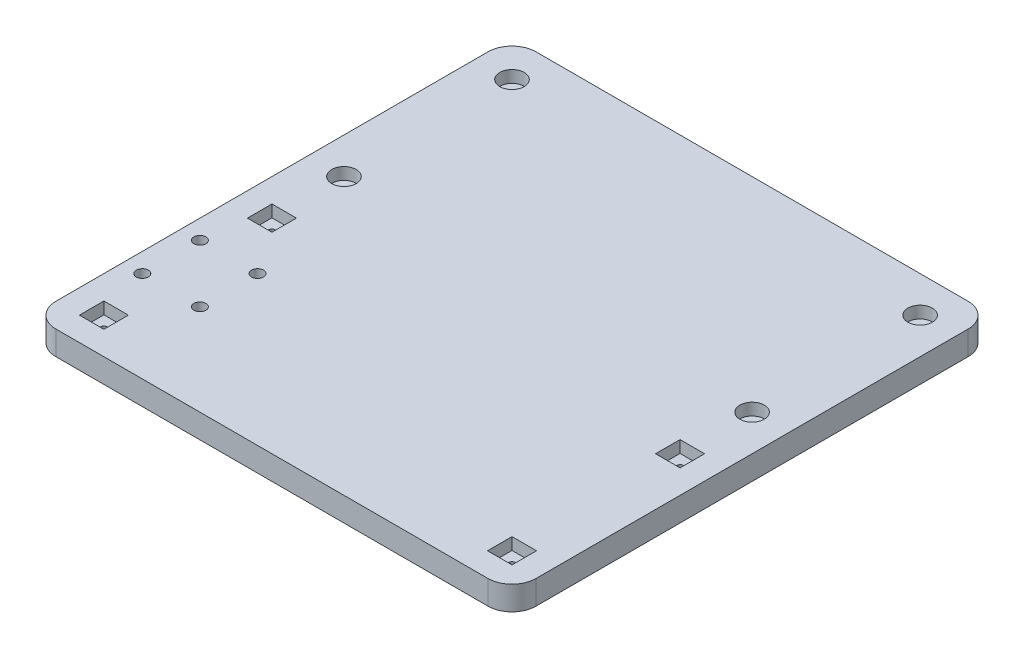
from build123d import *

# Parameters (mm, degrees)
SKETCH_1_W          = 200
SKETCH_1_H          = 200
EXTRUDE_1_DEPTH     = 10
SKETCH_2_W          = 10.2
SKETCH_2_H          = 10.2
CUT_EXTRUDE_3_DEPTH = 5
FILLET_1_R          = 10
SKETCH_3_R          = 5.1
CUT_EXTRUDE_1_DEPTH = 5
SKETCH_4_R          = 2.5
CUT_EXTRUDE_2_DEPTH = 142.774468788
SKETCH_5_R          = 1.5
CUT_EXTRUDE_4_DEPTH = 142.774468788


with BuildPart() as part:
    # ｽｹｯﾁ1 → ﾎﾞｽ - 押し出し1 (new body)
    with BuildSketch(Plane(origin=(0, 0, 0), x_dir=(1, 0, 0), z_dir=(0, 1, 0))):
        Rectangle(SKETCH_1_W, SKETCH_1_H)
    extrude(amount=EXTRUDE_1_DEPTH)

    # ｽｹｯﾁ2 → ｶｯﾄ - 押し出し3 (cut)
    with BuildSketch(Plane(origin=(0, 10, 0), x_dir=(1, 0, 0), z_dir=(0, 1, 0))):
        with Locations((-85, -15)):
            Rectangle(SKETCH_2_W, SKETCH_2_H)
        with Locations((85, -15)):
            Rectangle(SKETCH_2_W, SKETCH_2_H)
        with Locations((-85, -85)):
            Rectangle(SKETCH_2_W, SKETCH_2_H)
        with Locations((85, -85)):
            Rectangle(SKETCH_2_W, SKETCH_2_H)
    extrude(amount=-CUT_EXTRUDE_3_DEPTH, mode=Mode.SUBTRACT)

    # ﾌｨﾚｯﾄ1
    fillet_1_edges = [part.edges().sort_by_distance(p)[0] for p in [
        (100, 5, 100),
        (-100, 5, 100),
        (-100, 5, -100),
        (100, 5, -100),
    ]]
    fillet(fillet_1_edges, radius=FILLET_1_R)

    # ｽｹｯﾁ3 → ｶｯﾄ - 押し出し1 (cut)
    with BuildSketch(Plane(origin=(0, 10, 0), x_dir=(1, 0, 0), z_dir=(0, 1, 0))):
        with Locations(Location((-85, 85, 0), (0, 0, 270))):
            Circle(SKETCH_3_R)
        with Locations(Location((85, 85, 0), (0, 0, 270))):
            Circle(SKETCH_3_R)
        with Locations(Location((-85, 15, 0), (0, 0, 270))):
            Circle(SKETCH_3_R)
        with Locations(Location((85, 15, 0), (0, 0, 270))):
            Circle(SKETCH_3_R)
    extrude(amount=-CUT_EXTRUDE_1_DEPTH, mode=Mode.SUBTRACT)

    # ｽｹｯﾁ4 → ｶｯﾄ - 押し出し2 (cut, through all)
    with BuildSketch(Plane(origin=(0, 10, 0), x_dir=(1, 0, 0), z_dir=(0, 1, 0))):
        with Locations(Location((-68, -38, 0), (0, 0, 270))):
            Circle(SKETCH_4_R)
        with Locations(Location((-68, -62, 0), (0, 0, 270))):
            Circle(SKETCH_4_R)
        with Locations(Location((-92, -62, 0), (0, 0, 270))):
            Circle(SKETCH_4_R)
        with Locations(Location((-92, -38, 0), (0, 0, 270))):
            Circle(SKETCH_4_R)
    extrude(amount=-CUT_EXTRUDE_2_DEPTH, mode=Mode.SUBTRACT)

    # ｽｹｯﾁ5 → ｶｯﾄ - 押し出し4 (cut, through all)
    with BuildSketch(Plane.XZ):
        with Locations(Location((-85, 85, 0), (0, 0, 270))):
            Circle(SKETCH_5_R)
        with Locations(Location((85, 85, 0), (0, 0, 270))):
            Circle(SKETCH_5_R)
        with Locations(Location((-85, 15, 0), (0, 0, 270))):
            Circle(SKETCH_5_R)
        with Locations(Location((85, 15, 0), (0, 0, 270))):
            Circle(SKETCH_5_R)
    extrude(amount=-CUT_EXTRUDE_4_DEPTH, mode=Mode.SUBTRACT)


solid = part.part
